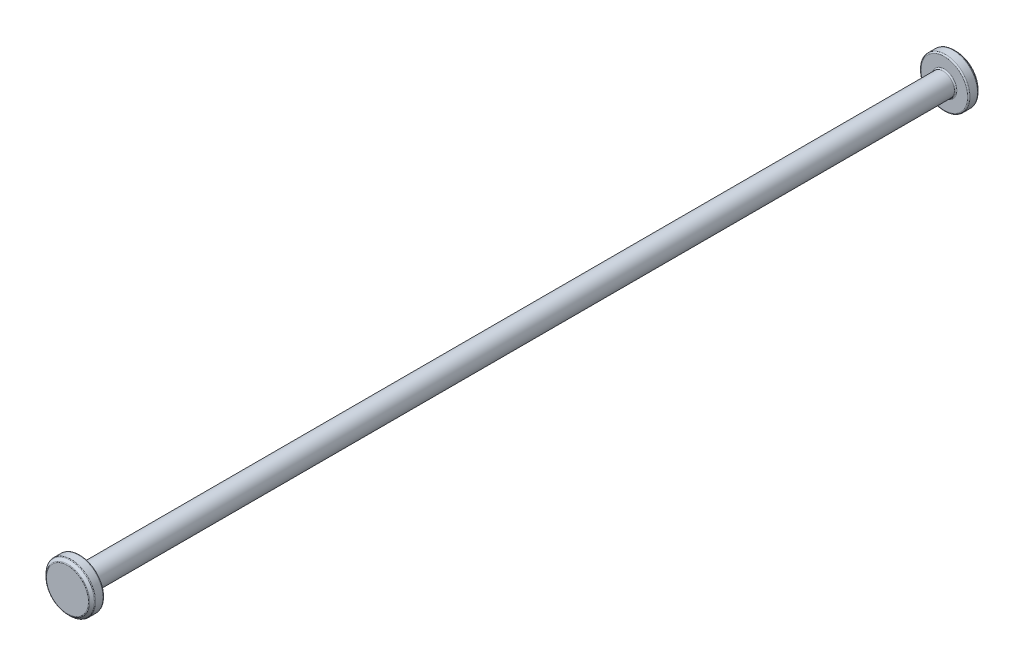
from build123d import *

# Parameters (mm, degrees)
SKETCH1_R           = 0.925
BOSS_EXTRUDE1_DEPTH = 35.25
SKETCH2_R           = 2
BOSS_EXTRUDE2_DEPTH = 1
CHAMFER1_SIZE       = 0.25
FILLET1_R           = 0.1


with BuildPart() as part:
    # Sketch1 → Boss-Extrude1 (new body)
    with BuildSketch(Plane.XY):
        Circle(SKETCH1_R)
    extrude(amount=BOSS_EXTRUDE1_DEPTH)

    # Sketch2 → Boss-Extrude2 (add)
    with BuildSketch(Plane.XY.offset(35.25)):
        Circle(SKETCH2_R)
    extrude(amount=BOSS_EXTRUDE2_DEPTH)

    # Chamfer1
    chamfer1_edges = [part.edges().sort_by_distance(p)[0] for p in [
        (-2, 0, 36.25),
    ]]
    chamfer(chamfer1_edges, length=CHAMFER1_SIZE)

    # Mirror1: part across plane


with BuildPart() as part_1:
    add(part.part)
    add(part.part.mirror(Plane.XY))

    # Fillet1
    fillet1_edges = [part_1.edges().sort_by_distance(p)[0] for p in [
        (-1.75, 0, 36.25),
        (-2, 0, 36),
        (-0.925, 0, -35.25),
        (-2, 0, -35.25),
        (-2, 0, -36),
        (-1.75, 0, -36.25),
        (-0.925, 0, 35.25),
        (-2, 0, 35.25),
    ]]
    fillet(fillet1_edges, radius=FILLET1_R)


solid = part_1.part
